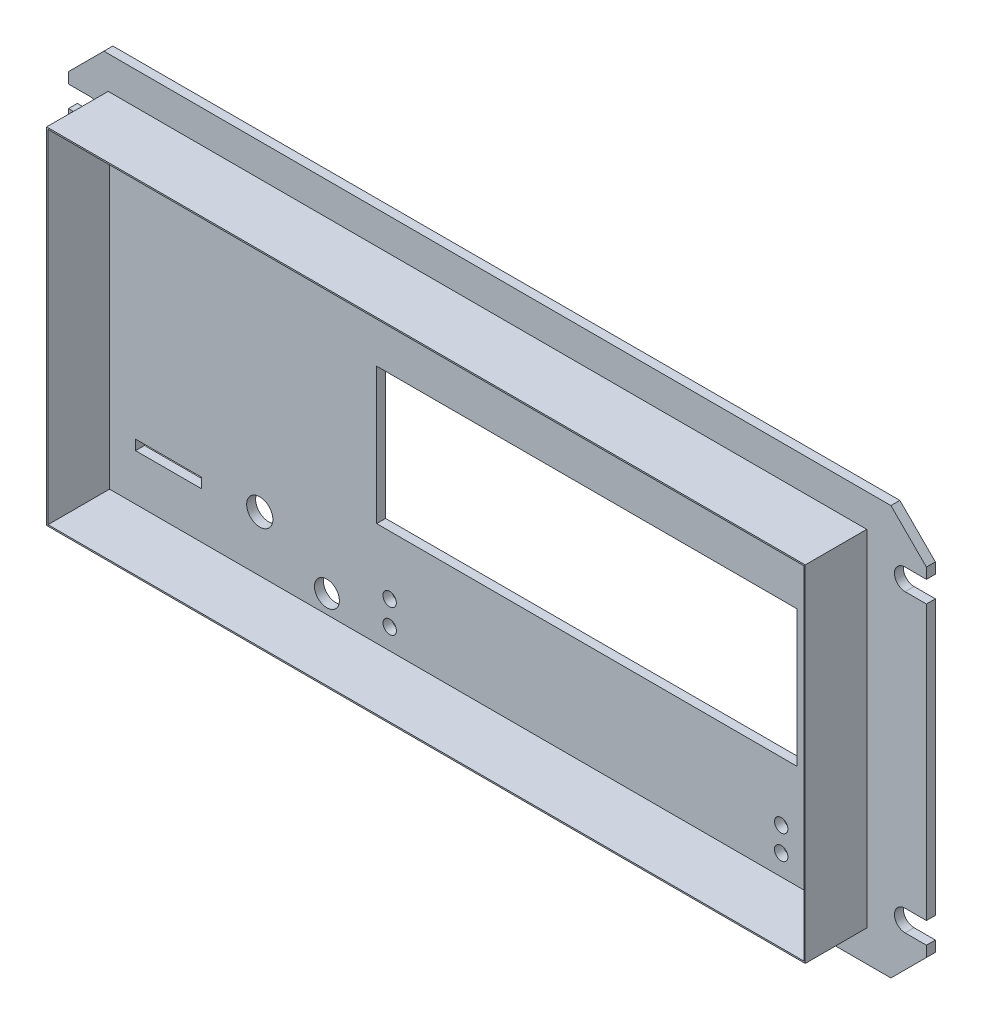
from build123d import *

# Parameters (mm, degrees)
BOSS_EXTRUDE1_DEPTH  = 1.6002
CUT_EXTRUDE1_DEPTH   = 169.893706928
CUT_EXTRUDE2_DEPTH   = 169.893706928
CUT_EXTRUDE3_DEPTH   = 169.893706928
CUT_EXTRUDE4_DEPTH   = 169.893706928
SKETCH6_W            = 135.636
SKETCH6_H            = 61.722
BOSS_EXTRUDE2_DEPTH  = 11
SKETCH7_W            = 135.128
SKETCH7_H            = 61.214
CUT_EXTRUDE5_DEPTH   = 11
SKETCH8_W            = 75.184
SKETCH8_H            = 24.384
CUT_EXTRUDE6_DEPTH   = 170.243976555
SKETCH9_W            = 11.792676588
SKETCH9_H            = 1.790289347
CUT_EXTRUDE7_DEPTH   = 170.355509624
M2_CLEARANCE_HOLE1_D = 2.39776
M4_CLEARANCE_HOLE1_D = 4.445
M4_CLEARANCE_HOLE2_D = 4.68589235


with BuildPart() as part:
    # Sketch1 → Boss-Extrude1 (new body)
    with BuildSketch(Plane.XY.offset(1.6002)):
        Polygon((6.35, 70.612), (0, 64.262), (0, 3.81), (6.35, -2.54), (147.066, -2.54), (153.416, 3.81), (153.416, 64.262), (147.066, 70.612), align=None)
    extrude(amount=-BOSS_EXTRUDE1_DEPTH)

    # Sketch2 → Cut-Extrude1 (cut, through all)
    with BuildSketch(Plane(origin=(0, 0, 0), x_dir=(-1, 0, 0), z_dir=(0, 0, -1))):
        with BuildLine():
            Line((-153.416, 9.525), (-153.416, 5.715))
            Line((-153.416, 5.715), (-149.606, 5.715))
            ThreePointArc((-149.606, 5.715), (-147.701, 7.62), (-149.606, 9.525))
            Line((-149.606, 9.525), (-153.416, 9.525))
        make_face()
    extrude(amount=-CUT_EXTRUDE1_DEPTH, mode=Mode.SUBTRACT)

    # Sketch3 → Cut-Extrude2 (cut, through all)
    with BuildSketch(Plane(origin=(0, 0, 0), x_dir=(-1, 0, 0), z_dir=(0, 0, -1))):
        with BuildLine():
            Line((-153.416, 62.357), (-153.416, 58.547))
            Line((-153.416, 58.547), (-149.606, 58.547))
            ThreePointArc((-149.606, 58.547), (-147.701, 60.452), (-149.606, 62.357))
            Line((-149.606, 62.357), (-153.416, 62.357))
        make_face()
    extrude(amount=-CUT_EXTRUDE2_DEPTH, mode=Mode.SUBTRACT)

    # Sketch4 → Cut-Extrude3 (cut, through all)
    with BuildSketch(Plane(origin=(0, 0, 0), x_dir=(-1, 0, 0), z_dir=(0, 0, -1))):
        with BuildLine():
            Line((0, 58.547), (0, 62.357))
            Line((0, 62.357), (-3.81, 62.357))
            ThreePointArc((-3.81, 62.357), (-5.715, 60.452), (-3.81, 58.547))
            Line((-3.81, 58.547), (0, 58.547))
        make_face()
    extrude(amount=-CUT_EXTRUDE3_DEPTH, mode=Mode.SUBTRACT)

    # Sketch5 → Cut-Extrude4 (cut, through all)
    with BuildSketch(Plane(origin=(0, 0, 0), x_dir=(-1, 0, 0), z_dir=(0, 0, -1))):
        with BuildLine():
            Line((0, 5.715), (0, 9.525))
            Line((0, 9.525), (-3.81, 9.525))
            ThreePointArc((-3.81, 9.525), (-5.715, 7.62), (-3.81, 5.715))
            Line((-3.81, 5.715), (0, 5.715))
        make_face()
    extrude(amount=-CUT_EXTRUDE4_DEPTH, mode=Mode.SUBTRACT)

    # Sketch6 → Boss-Extrude2 (add)
    with BuildSketch(Plane.XY.offset(1.6002)):
        with Locations((74.93, 33.909)):
            Rectangle(SKETCH6_W, SKETCH6_H)
    extrude(amount=BOSS_EXTRUDE2_DEPTH)

    # Sketch7 → Cut-Extrude5 (cut)
    with BuildSketch(Plane.XY.offset(12.6002)):
        with Locations((74.93, 33.909)):
            Rectangle(SKETCH7_W, SKETCH7_H)
    extrude(amount=-CUT_EXTRUDE5_DEPTH, mode=Mode.SUBTRACT)

    # Sketch8 → Cut-Extrude6 (cut, through all)
    with BuildSketch(Plane.XY.offset(1.6002)):
        with Locations((92.71, 34.036)):
            Rectangle(SKETCH8_W, SKETCH8_H)
    extrude(amount=-CUT_EXTRUDE6_DEPTH, mode=Mode.SUBTRACT)

    # Sketch9 → Cut-Extrude7 (cut, through all)
    with BuildSketch(Plane(origin=(0, 0, 0), x_dir=(-1, 0, 0), z_dir=(0, 0, -1))):
        with Locations((-17.905053156, 12.47860787)):
            Rectangle(SKETCH9_W, SKETCH9_H)
    extrude(amount=-CUT_EXTRUDE7_DEPTH, mode=Mode.SUBTRACT)

    # M2 Clearance Hole1 (through all)
    with Locations(Plane.XY.offset(1.6002)):
        with Locations((127.4445, 6.98246), (127.44958, 11.303), (57.4548, 7.03326), (57.43956, 11.32332)):
            Hole(M2_CLEARANCE_HOLE1_D / 2)

    # M4 Clearance Hole1 (through all)
    with Locations(Plane.XY.offset(1.6002)):
        with Locations((46.228, 61.5696), (46.228, 6.5786), (139.2174, 6.5786), (139.2428, 61.5696)):
            Hole(M4_CLEARANCE_HOLE1_D / 2)

    # M4 Clearance Hole2 (through all)
    with Locations(Plane.XY.offset(1.6002)):
        with Locations((34.22065157, 13.205568935)):
            Hole(M4_CLEARANCE_HOLE2_D / 2)


solid = part.part
